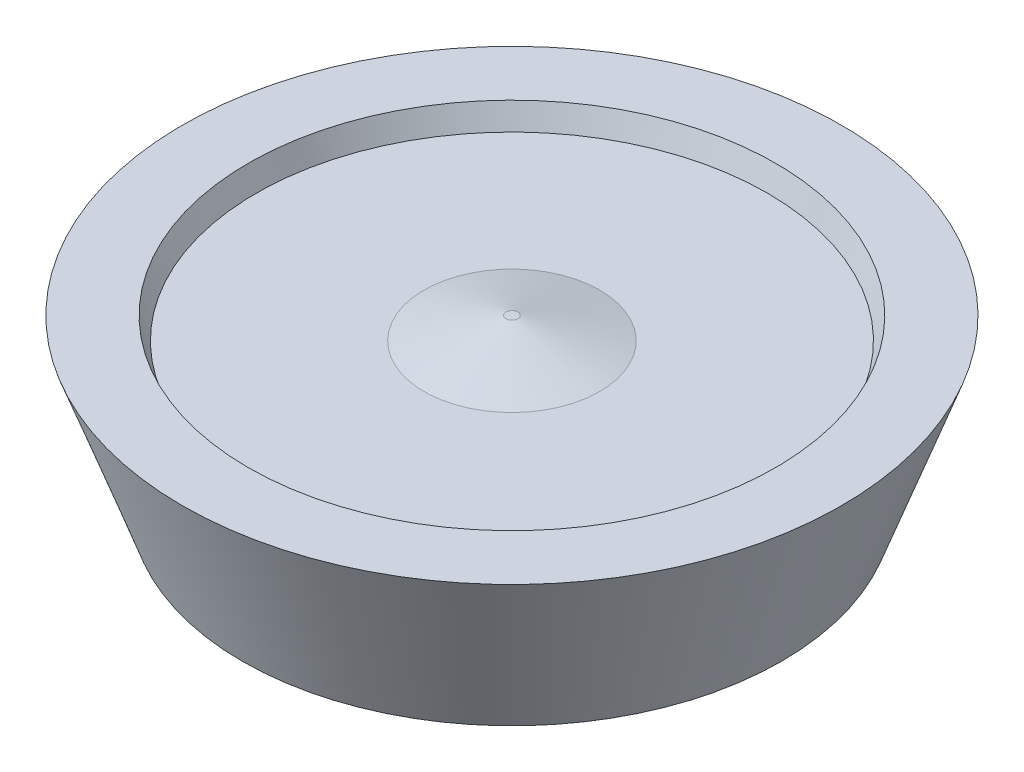
from build123d import *


with BuildPart() as part:
    # Sketch1 → Revolve1 (revolve)
    with BuildSketch(Plane(origin=(0, 0, 0), x_dir=(-1, 0, 0), z_dir=(0, 0, -1)), mode=Mode.PRIVATE) as revolve1_sk:
        Polygon((-24.540446486, -15), (0, -15), (0, 0), (-0.535898385, 0), (-8, -2), (-23.272059531, -2), (-24, 0), (-30, 0), align=None)
    revolve(revolve1_sk.sketch.rotate(Axis((0, -15, 0), (0, 1, 0)), 270), axis=Axis((0, -15, 0), (0, 1, 0)))


solid = part.part
